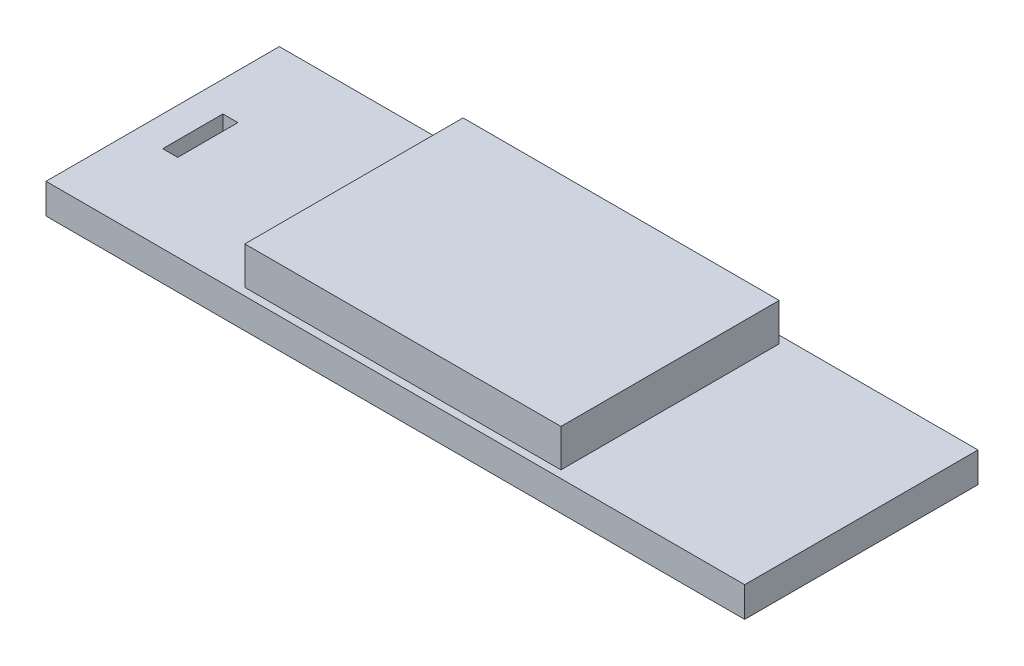
from build123d import *

# Parameters (mm, degrees)
SK_BASE_W                  = 92.82
SK_BASE_H                  = 31
BASE_PLATE_DEPTH           = 4
SK_BLOCK_W                 = 42
SK_BLOCK_H                 = 29
CAMERA_BLOCK_DEPTH         = 5
SK_PINHOLE_R               = 1.8
SLIDE_PIN_HOLE_DEPTH       = 4
CABLE_TIE_SLOTS_DEPTH      = 95.534662426
CABLE_TIE_SLOTS_DEPTH_BACK = 95.534662426
SK_TIESLOTS_W              = 2
SK_TIESLOTS_H              = 8


with BuildPart() as part:
    # Sk_Base → Base Plate (new body)
    with BuildSketch(Plane(origin=(0, 0, 0), x_dir=(1, 0, 0), z_dir=(0, 1, 0))):
        with Locations((46.41, 0)):
            Rectangle(SK_BASE_W, SK_BASE_H)
    extrude(amount=BASE_PLATE_DEPTH)

    # Sk_Block → Camera Block (add)
    with BuildSketch(Plane(origin=(0, 4, 0), x_dir=(1, 0, 0), z_dir=(0, 1, 0))):
        with Locations((46.41, 0)):
            Rectangle(SK_BLOCK_W, SK_BLOCK_H)
    extrude(amount=CAMERA_BLOCK_DEPTH)

    # Sk_PinHole → Slide Pin Hole (cut)
    with BuildSketch(Plane(origin=(0, 0, 0), x_dir=(1, 0, 0), z_dir=(0, 1, 0))):
        with Locations(Location((46.41, 0, 0), (0, 0, 270))):
            Circle(SK_PINHOLE_R)
    extrude(amount=SLIDE_PIN_HOLE_DEPTH, mode=Mode.SUBTRACT)

    # Sk_TieSlots → Cable Tie Slots (cut, two sides: drawn at the far end of the back side and taken through both)
    with BuildSketch(Plane(origin=(0, 0, 0), x_dir=(1, 0, 0), z_dir=(0, 1, 0)).offset(-CABLE_TIE_SLOTS_DEPTH_BACK)):
        with Locations((5, 0)):
            Rectangle(SK_TIESLOTS_W, SK_TIESLOTS_H)
        with Locations((23, 0)):
            Rectangle(SK_TIESLOTS_W, SK_TIESLOTS_H)
    extrude(amount=CABLE_TIE_SLOTS_DEPTH + CABLE_TIE_SLOTS_DEPTH_BACK, mode=Mode.SUBTRACT)


solid = part.part
